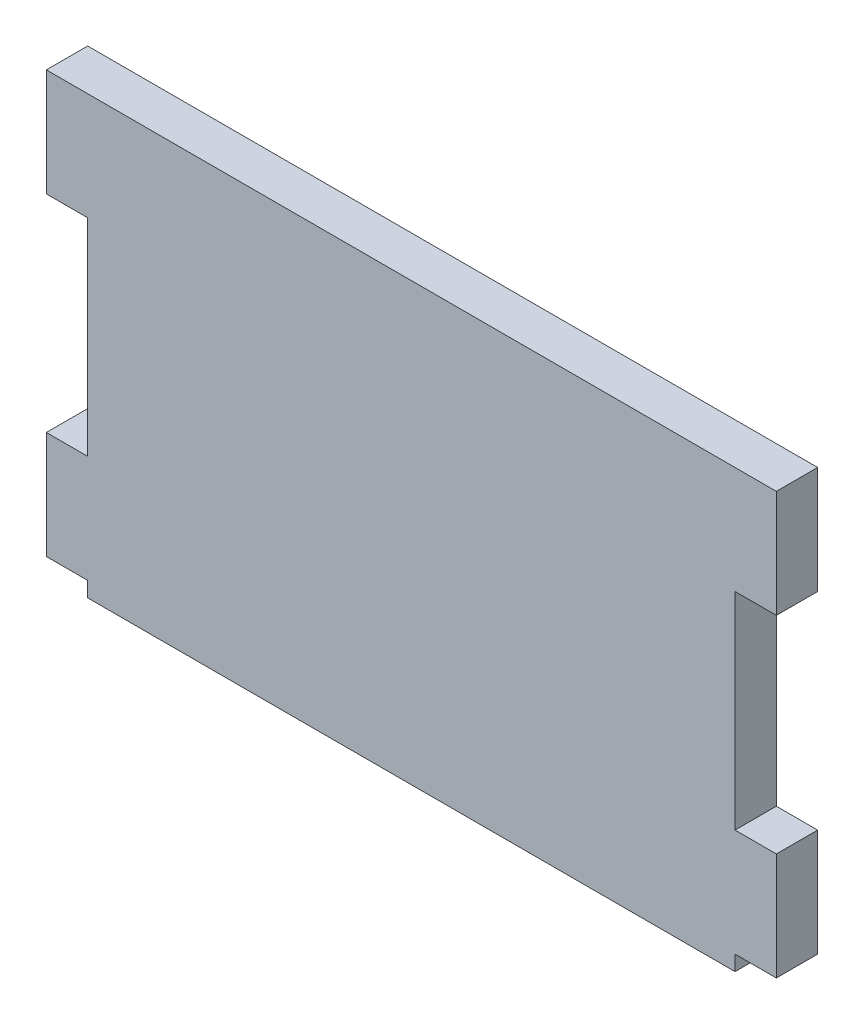
from build123d import *

# Parameters (mm, degrees)
SKETCH1_W           = 53
SKETCH1_H           = 31.7
BOSS_EXTRUDE1_DEPTH = 3
SKETCH2_W           = 3
SKETCH2_H           = 15
CUT_EXTRUDE1_DEPTH  = 45.306907356
LPATTERN1_COUNT     = 3
LPATTERN1_PITCH     = 22.8


with BuildPart() as part:
    # Sketch1 → Boss-Extrude1 (new body)
    with BuildSketch(Plane.XY):
        with Locations((-14.493460648, 0.692013889)):
            Rectangle(SKETCH1_W, SKETCH1_H)
    extrude(amount=BOSS_EXTRUDE1_DEPTH)

    # Sketch2 → Cut-Extrude1 (cut, through all)
    with BuildSketch(Plane.XY.offset(3)):
        with Locations((-39.493460648, 1.242013889)):
            Rectangle(SKETCH2_W, SKETCH2_H)
        with Locations((10.506539352, 1.242013889)):
            Rectangle(SKETCH2_W, SKETCH2_H)
    cut_extrude1 = extrude(amount=-CUT_EXTRUDE1_DEPTH, mode=Mode.SUBTRACT)

    # LPattern1: Cut-Extrude1 ×3
    with Locations(*[(0, -i * LPATTERN1_PITCH, 0) for i in range(1, LPATTERN1_COUNT)]):
        add(cut_extrude1, mode=Mode.SUBTRACT)


solid = part.part
